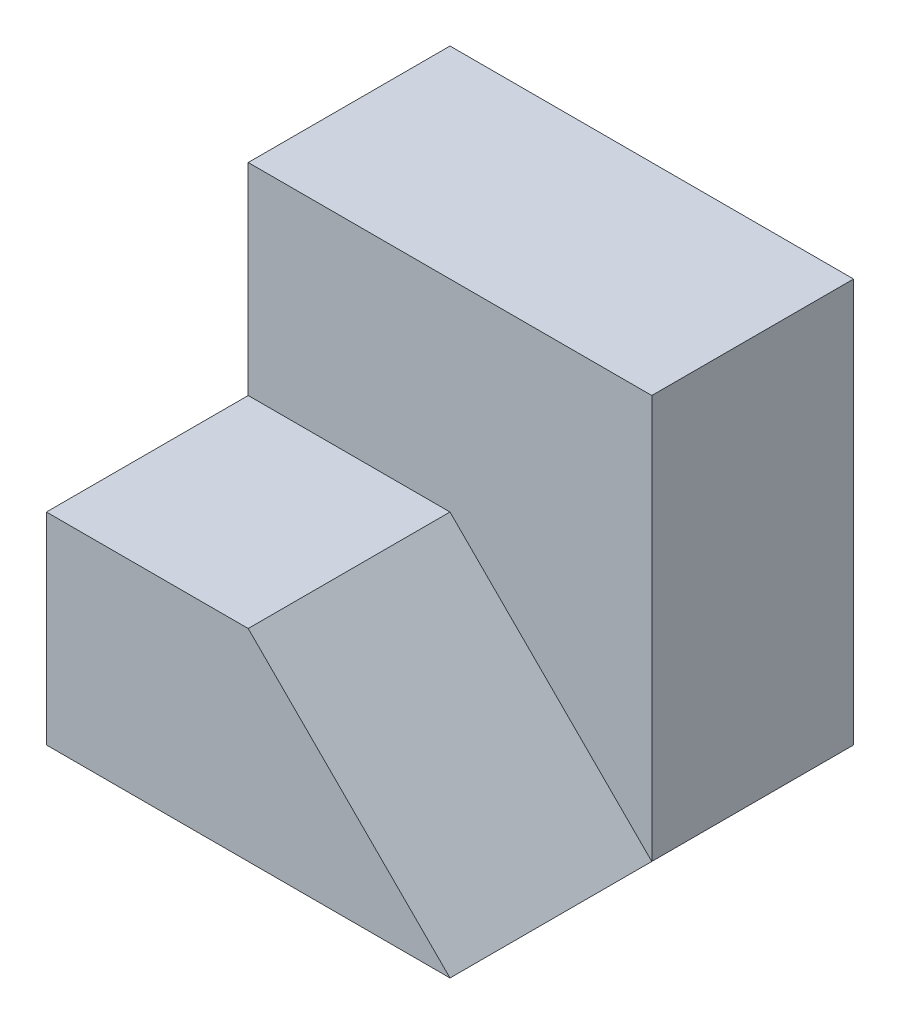
from build123d import *

# Parameters (mm, degrees)
RESSALTO_EXTRUS_O1_DEPTH = 30
ESBO_O2_W                = 60
ESBO_O2_H                = 60
RESSALTO_EXTRUS_O2_DEPTH = 30


with BuildPart() as part:
    # Esboço1 → Ressalto-extrusão1 (new body)
    with BuildSketch(Plane.XY):
        Polygon((0, 0), (60, 0), (30, 30), (0, 30), align=None)
    extrude(amount=RESSALTO_EXTRUS_O1_DEPTH)

    # Esboço2 → Ressalto-extrusão2 (add)
    with BuildSketch(Plane(origin=(0, 0, 0), x_dir=(-1, 0, 0), z_dir=(0, 0, -1))):
        with Locations((-30, 30)):
            Rectangle(ESBO_O2_W, ESBO_O2_H)
    extrude(amount=RESSALTO_EXTRUS_O2_DEPTH)


solid = part.part
